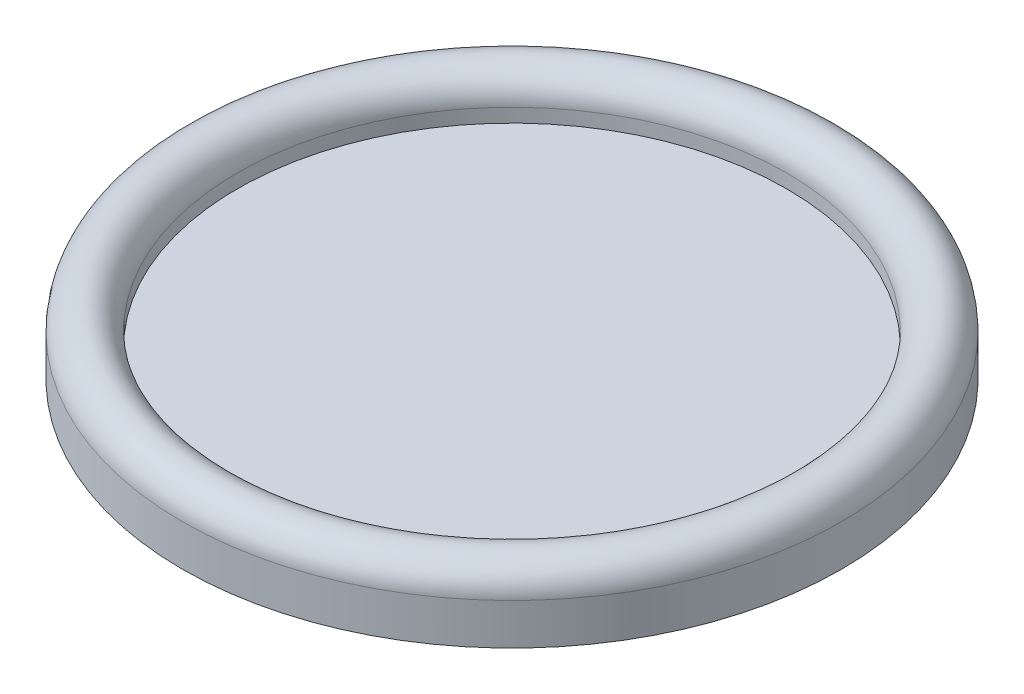
from build123d import *


with BuildPart() as part:
    # Sketch1 → Revolve2 (revolve)
    with BuildSketch(Plane.XY, mode=Mode.PRIVATE) as revolve2_sk:
        with BuildLine():
            ThreePointArc((-76.2, 9.525), (-69.85, 15.875), (-63.5, 9.525))
            Line((-63.5, 9.525), (-63.5, 6.35))
            Line((-63.5, 6.35), (0, 6.35))
            Line((0, 6.35), (0, 0))
            Line((0, 0), (-76.2, 0))
            Line((-76.2, 0), (-76.2, 9.525))
        make_face()
        with BuildLine():
            ThreePointArc((0, -13.577223759), (-38.700067846, -10.156396829), (-76.2, 0))
            Line((-76.2, 0), (0, 0))
            Line((0, 0), (0, -13.577223759))
        make_face()
    revolve(revolve2_sk.sketch.rotate(Axis((0, 6.35, 0), (0, -1, 0)), 270), axis=Axis((0, 6.35, 0), (0, -1, 0)))


solid = part.part
